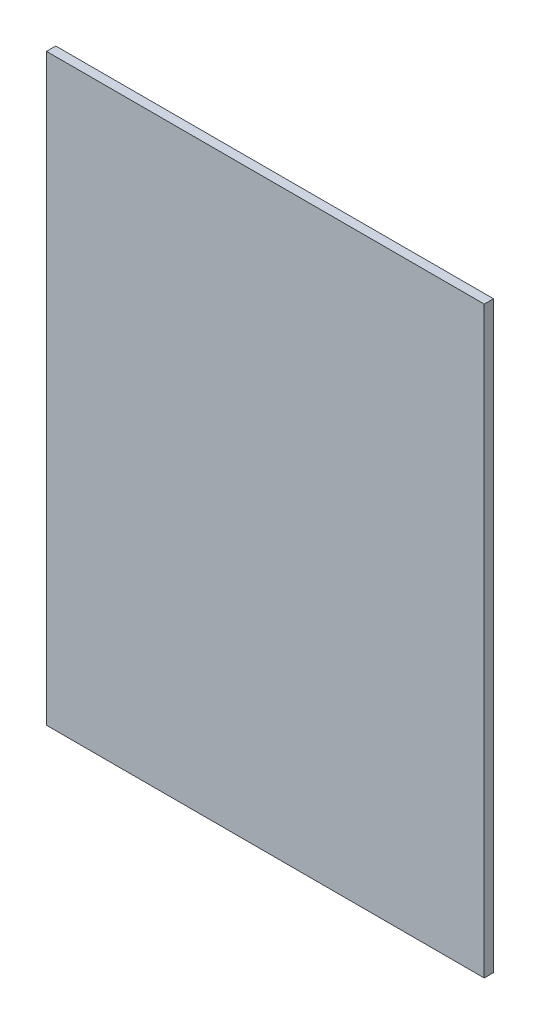
from build123d import *

# Parameters (mm, degrees)
SKETCH1_W           = 300
SKETCH1_H           = 400
BOSS_EXTRUDE1_DEPTH = 6.35


with BuildPart() as part:
    # Sketch1 → Boss-Extrude1 (new body)
    with BuildSketch(Plane.XY):
        with Locations((112.932384342, 183.174377224)):
            Rectangle(SKETCH1_W, SKETCH1_H)
    extrude(amount=BOSS_EXTRUDE1_DEPTH)


solid = part.part
